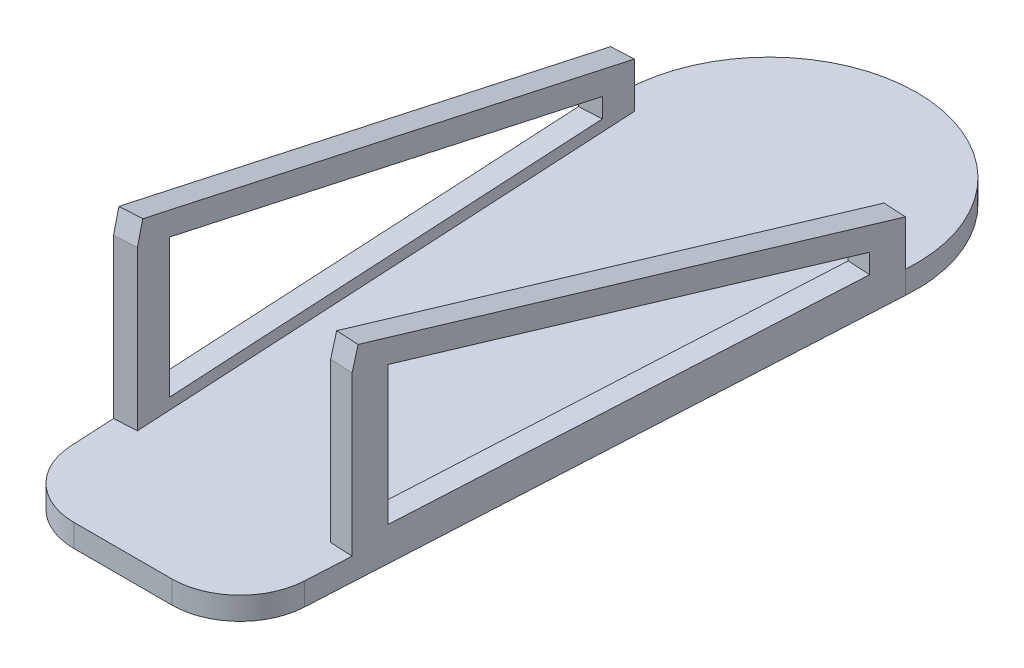
from build123d import *

# Parameters (mm, degrees)
EXTRUDE_1_DEPTH = 10
EXTRUDE_2_DEPTH = 10


with BuildPart() as part:
    # 草图1 → 凸台-拉伸1 (new body)
    with BuildSketch(Plane(origin=(0, 0, 0), x_dir=(1, 0, 0), z_dir=(0, 1, 0))):
        with BuildLine():
            Line((-65, 130), (-51.521169198, -121.604841641))
            ThreePointArc((-51.521169198, -121.604841641), (-42.202133258, -141.773208873), (-21.56412523, -150))
            Line((-21.56412523, -150), (21.56412523, -150))
            ThreePointArc((21.56412523, -150), (42.202133258, -141.773208873), (51.521169198, -121.604841641))
            Line((51.521169198, -121.604841641), (65, 130))
            ThreePointArc((65, 130), (0, 200), (-65, 130))
        make_face()
    extrude(amount=EXTRUDE_1_DEPTH)

    # 草图2 → 凸台-拉伸2 (add)
    with BuildSketch(Plane(origin=(57.86963434, 0, 3.100158983), x_dir=(0.053494721371611875, 0, -0.9985681322700888), z_dir=(0.9985681322700889, 0, 0.05349472137161188))):
        Polygon((-96.114027072, 89.677890258), (133.291014084, 30), (133.291014084, 10), (-98.63165297, 10), (-98.63165297, 80), align=None)
        Polygon((-83.63165297, 76.097869736), (118.291014084, 23.569299726), (118.291014084, 15), (-83.63165297, 15), align=None, mode=Mode.SUBTRACT)
    extrude_2 = extrude(amount=-EXTRUDE_2_DEPTH)

    # 镜向1: 凸台-拉伸2 across plane
    add(extrude_2.mirror(Plane(origin=(0, 0, 0), x_dir=(0, 0, 1), z_dir=(1, 0, 0))))


solid = part.part
